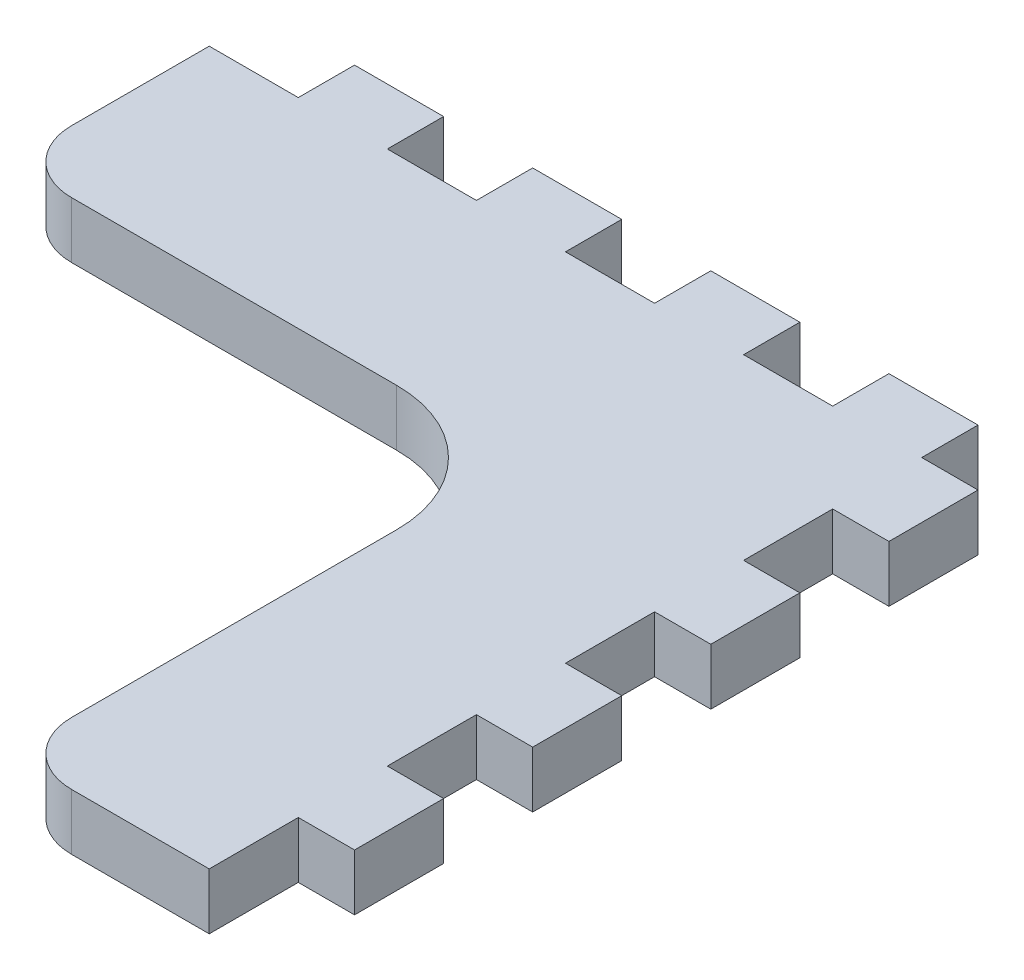
from build123d import *

# Parameters (mm, degrees)
EXTRUDE_1_DEPTH = 4.5


with BuildPart() as part:
    # 草图1 → 凸台-拉伸1 (new body)
    with BuildSketch(Plane(origin=(0, 0, 0), x_dir=(1, 0, 0), z_dir=(0, 1, 0))):
        with BuildLine():
            Line((23.680785271, 18.799740126), (23.680785271, 11.674740126))
            Line((23.680785271, 11.674740126), (19.180785271, 11.674740126))
            Line((19.180785271, 11.674740126), (19.180785271, 4.549740126))
            Line((19.180785271, 4.549740126), (23.680785271, 4.549740126))
            Line((23.680785271, 4.549740126), (23.680785271, -2.575259874))
            Line((23.680785271, -2.575259874), (19.180785271, -2.575259874))
            Line((19.180785271, -2.575259874), (19.180785271, -9.700259874))
            Line((19.180785271, -9.700259874), (23.680785271, -9.700259874))
            Line((23.680785271, -9.700259874), (23.680785271, -16.825259874))
            Line((23.680785271, -16.825259874), (19.180785271, -16.825259874))
            Line((19.180785271, -16.825259874), (19.180785271, -23.950259874))
            Line((19.180785271, -23.950259874), (23.680785271, -23.950259874))
            Line((23.680785271, -23.950259874), (23.680785271, -31.075259874))
            Line((23.680785271, -31.075259874), (19.180785271, -31.075259874))
            Line((19.180785271, -31.075259874), (19.180785271, -38.200259874))
            Line((19.180785271, -38.200259874), (8.180785271, -38.200259874))
            ThreePointArc((8.180785271, -38.200259874), (4.645251365, -36.73579378), (3.180785271, -33.200259874))
            Line((3.180785271, -33.200259874), (3.180785271, -7.200259874))
            ThreePointArc((3.180785271, -7.200259874), (0.251853083, -0.129192062), (-6.819214729, 2.799740126))
            Line((-6.819214729, 2.799740126), (-32.819214729, 2.799740126))
            ThreePointArc((-32.819214729, 2.799740126), (-36.354748635, 4.26420622), (-37.819214729, 7.799740126))
            Line((-37.819214729, 7.799740126), (-37.819214729, 18.799740126))
            Line((-37.819214729, 18.799740126), (-30.694214729, 18.799740126))
            Line((-30.694214729, 18.799740126), (-30.694214729, 23.299740126))
            Line((-30.694214729, 23.299740126), (-23.569214729, 23.299740126))
            Line((-23.569214729, 23.299740126), (-23.569214729, 18.799740126))
            Line((-23.569214729, 18.799740126), (-16.444214729, 18.799740126))
            Line((-16.444214729, 18.799740126), (-16.444214729, 23.299740126))
            Line((-16.444214729, 23.299740126), (-9.319214729, 23.299740126))
            Line((-9.319214729, 23.299740126), (-9.319214729, 18.799740126))
            Line((-9.319214729, 18.799740126), (-2.194214729, 18.799740126))
            Line((-2.194214729, 18.799740126), (-2.194214729, 23.299740126))
            Line((-2.194214729, 23.299740126), (4.930785271, 23.299740126))
            Line((4.930785271, 23.299740126), (4.930785271, 18.799740126))
            Line((4.930785271, 18.799740126), (12.055785271, 18.799740126))
            Line((12.055785271, 18.799740126), (12.055785271, 23.299740126))
            Line((12.055785271, 23.299740126), (19.180785271, 23.299740126))
            Line((19.180785271, 23.299740126), (19.180785271, 18.799740126))
            Line((19.180785271, 18.799740126), (23.680785271, 18.799740126))
        make_face()
    extrude(amount=EXTRUDE_1_DEPTH)


solid = part.part
